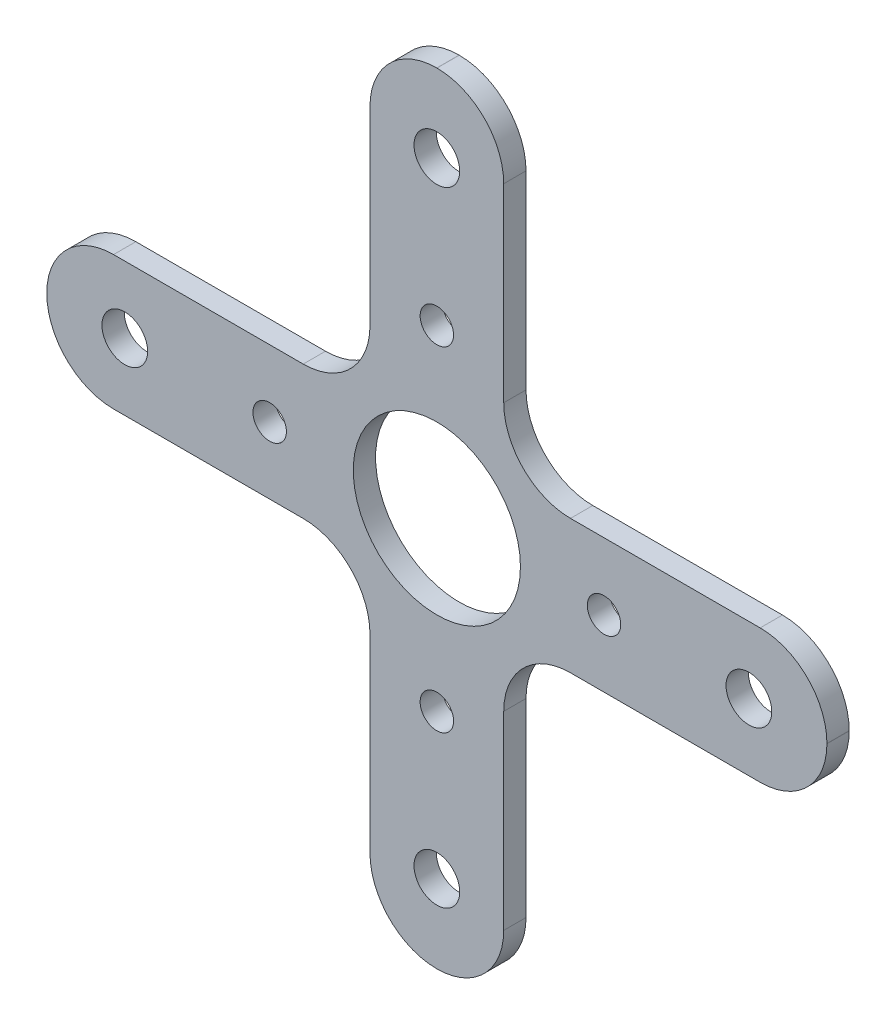
from build123d import *

# Parameters (mm, degrees)
SKETCH1_R           = 7.5
SKETCH1_R_2         = 2.05
SKETCH1_R_3         = 1.5
BOSS_EXTRUDE1_DEPTH = 2


with BuildPart() as part:
    # Sketch1 → Boss-Extrude1 (new body)
    with BuildSketch(Plane.XY):
        with BuildLine():
            Line((11.99, -6), (29.01, -6))
            ThreePointArc((29.01, -6), (33.245569619, -4.245569619), (35, -0.01))
            Line((35, -0.01), (35, 0.01))
            ThreePointArc((35, 0.01), (33.245569619, 4.245569619), (29.01, 6))
            Line((29.01, 6), (11.99, 6))
            ThreePointArc((11.99, 6), (7.754430381, 7.754430381), (6, 11.99))
            Line((6, 11.99), (6, 29.01))
            ThreePointArc((6, 29.01), (4.245569619, 33.245569619), (0.01, 35))
            Line((0.01, 35), (-0.01, 35))
            ThreePointArc((-0.01, 35), (-4.245569619, 33.245569619), (-6, 29.01))
            Line((-6, 29.01), (-6, 11.99))
            ThreePointArc((-6, 11.99), (-7.754430381, 7.754430381), (-11.99, 6))
            Line((-11.99, 6), (-29.01, 6))
            ThreePointArc((-29.01, 6), (-33.245569619, 4.245569619), (-35, 0.01))
            Line((-35, 0.01), (-35, -0.01))
            ThreePointArc((-35, -0.01), (-33.245569619, -4.245569619), (-29.01, -6))
            Line((-29.01, -6), (-11.99, -6))
            ThreePointArc((-11.99, -6), (-7.754430381, -7.754430381), (-6, -11.99))
            Line((-6, -11.99), (-6, -29.01))
            ThreePointArc((-6, -29.01), (-4.245569619, -33.245569619), (-0.01, -35))
            Line((-0.01, -35), (0.01, -35))
            ThreePointArc((0.01, -35), (4.245569619, -33.245569619), (6, -29.01))
            Line((6, -29.01), (6, -11.99))
            ThreePointArc((6, -11.99), (7.754430381, -7.754430381), (11.99, -6))
        make_face()
        Circle(SKETCH1_R, mode=Mode.SUBTRACT)
        with Locations((-28, 0)):
            Circle(SKETCH1_R_2, mode=Mode.SUBTRACT)
        with Locations(Location((28, 0, 0), (0, 0, 180))):
            Circle(SKETCH1_R_2, mode=Mode.SUBTRACT)
        with Locations((0, 28)):
            Circle(SKETCH1_R_2, mode=Mode.SUBTRACT)
        with Locations(Location((0, -28, 0), (0, 0, 180))):
            Circle(SKETCH1_R_2, mode=Mode.SUBTRACT)
        with Locations((0, 15)):
            Circle(SKETCH1_R_3, mode=Mode.SUBTRACT)
        with Locations(Location((0, -15, 0), (0, 0, 180))):
            Circle(SKETCH1_R_3, mode=Mode.SUBTRACT)
        with Locations((-15, 0)):
            Circle(SKETCH1_R_3, mode=Mode.SUBTRACT)
        with Locations(Location((15, 0, 0), (0, 0, 180))):
            Circle(SKETCH1_R_3, mode=Mode.SUBTRACT)
    extrude(amount=BOSS_EXTRUDE1_DEPTH)


solid = part.part
